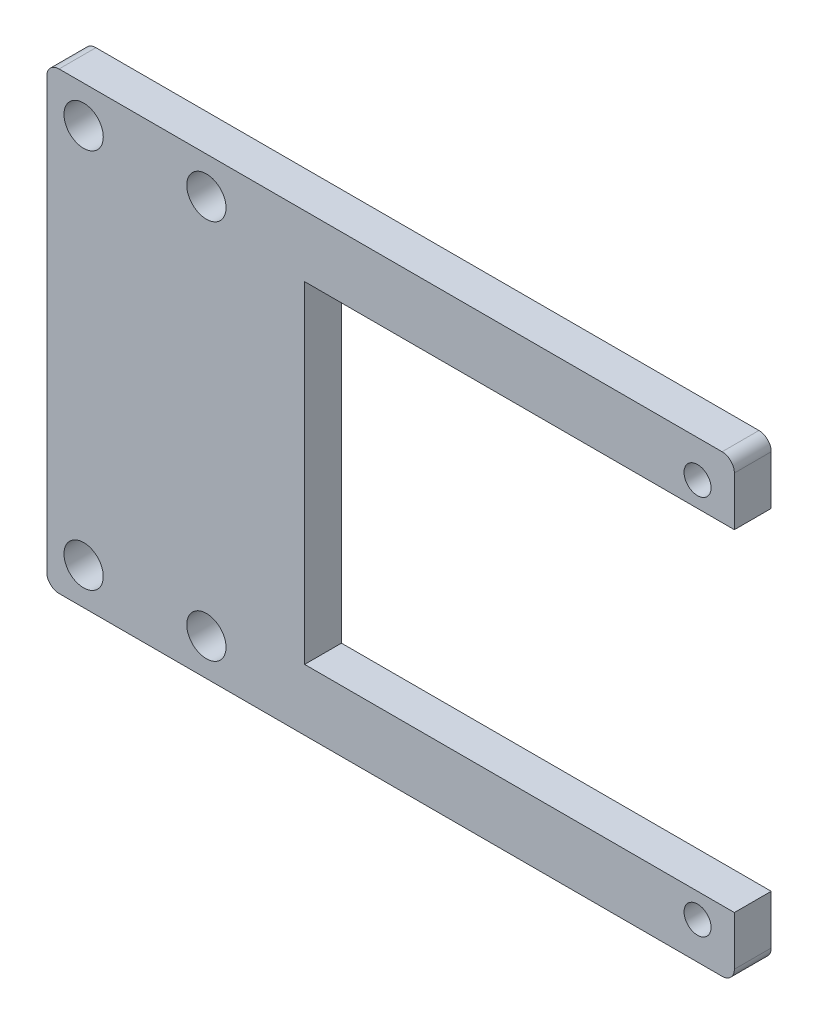
from build123d import *

# Parameters (mm, degrees)
SKETCH_2_R      = 1.1
SKETCH_2_R_2    = 1.6
EXTRUDE_1_DEPTH = 3
FILLET_1_R      = 1


with BuildPart() as part:
    # 草图2 → 凸台-拉伸1 (new body)
    with BuildSketch(Plane.XY):
        Polygon((28, 18.5), (28, 13.5), (-7, 13.5), (-7, -13.5), (28, -13.5), (28, -18.5), (-28, -18.5), (-28, 18.5), align=None)
        with Locations((25, 15.5)):
            Circle(SKETCH_2_R, mode=Mode.SUBTRACT)
        with Locations(Location((25, -15.5, 0), (0, 0, 180))):
            Circle(SKETCH_2_R, mode=Mode.SUBTRACT)
        with Locations((-25, 15.5)):
            Circle(SKETCH_2_R_2, mode=Mode.SUBTRACT)
        with Locations((-15, 15.5)):
            Circle(SKETCH_2_R_2, mode=Mode.SUBTRACT)
        with Locations(Location((-15, -15.5, 0), (0, 0, 180))):
            Circle(SKETCH_2_R_2, mode=Mode.SUBTRACT)
        with Locations(Location((-25, -15.5, 0), (0, 0, 180))):
            Circle(SKETCH_2_R_2, mode=Mode.SUBTRACT)
    extrude(amount=EXTRUDE_1_DEPTH)

    # 圆角1
    fillet_1_edges = [part.edges().sort_by_distance(p)[0] for p in [
        (28, 18.5, 1.5),
        (28, -18.5, 1.5),
        (-28, -18.5, 1.5),
        (-28, 18.5, 1.5),
    ]]
    fillet(fillet_1_edges, radius=FILLET_1_R)


solid = part.part
